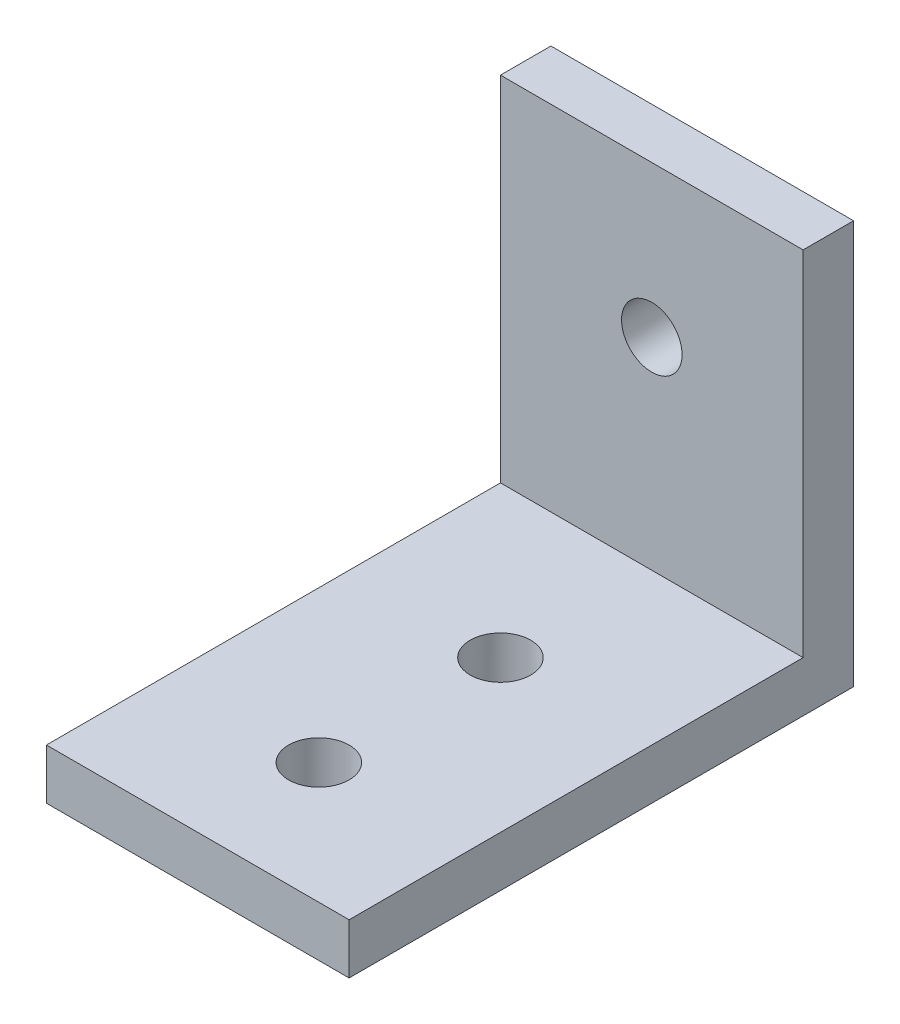
from build123d import *

# Parameters (mm, degrees)
SKETCH_1_W          = 30
SKETCH_1_H          = 50
EXTRUDE_1_DEPTH     = 5
SKETCH_2_W          = 30
SKETCH_2_H          = 40
EXTRUDE_2_DEPTH     = 5
SKETCH_3_R          = 3
CUT_EXTRUDE_1_DEPTH = 66.76473219
SKETCH_4_R          = 3
CUT_EXTRUDE_2_DEPTH = 66.76473219


with BuildPart() as part:
    # 草图1 → 凸台-拉伸1 (new body)
    with BuildSketch(Plane(origin=(0, 0, 0), x_dir=(1, 0, 0), z_dir=(0, 1, 0))):
        with Locations((0, -25)):
            Rectangle(SKETCH_1_W, SKETCH_1_H)
    extrude(amount=EXTRUDE_1_DEPTH)

    # 草图2 → 凸台-拉伸2 (add)
    with BuildSketch(Plane.XY):
        with Locations((0, 20)):
            Rectangle(SKETCH_2_W, SKETCH_2_H)
    extrude(amount=EXTRUDE_2_DEPTH)

    # 草图3 → 切除-拉伸1 (cut, through all)
    with BuildSketch(Plane(origin=(0, 0, 0), x_dir=(1, 0, 0), z_dir=(0, 1, 0))):
        with Locations(Location((0, -20, 0), (0, 0, 90))):
            Circle(SKETCH_3_R)
        with Locations(Location((0, -38, 0), (0, 0, 90))):
            Circle(SKETCH_3_R)
    extrude(amount=CUT_EXTRUDE_1_DEPTH, mode=Mode.SUBTRACT)

    # 草图4 → 切除-拉伸2 (cut, through all)
    with BuildSketch(Plane.XY):
        with Locations((0, 25)):
            Circle(SKETCH_4_R)
    extrude(amount=CUT_EXTRUDE_2_DEPTH, mode=Mode.SUBTRACT)


solid = part.part
